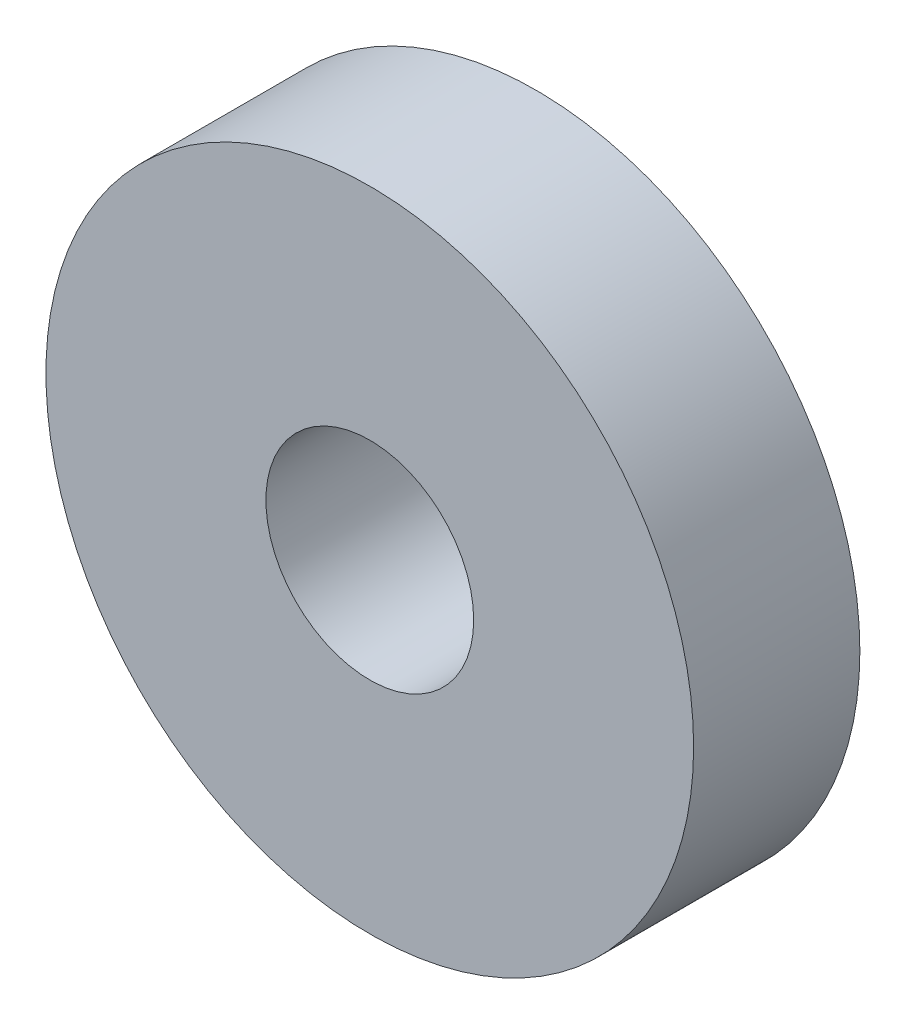
from build123d import *

# Parameters (mm, degrees)
SKETCH1_R           = 38.9636
SKETCH1_R_2         = 12.5
BOSS_EXTRUDE1_DEPTH = 20


with BuildPart() as part:
    # Sketch1 → Boss-Extrude1 (new body)
    with BuildSketch(Plane.XY):
        Circle(SKETCH1_R)
        Circle(SKETCH1_R_2, mode=Mode.SUBTRACT)
    extrude(amount=BOSS_EXTRUDE1_DEPTH)


solid = part.part
